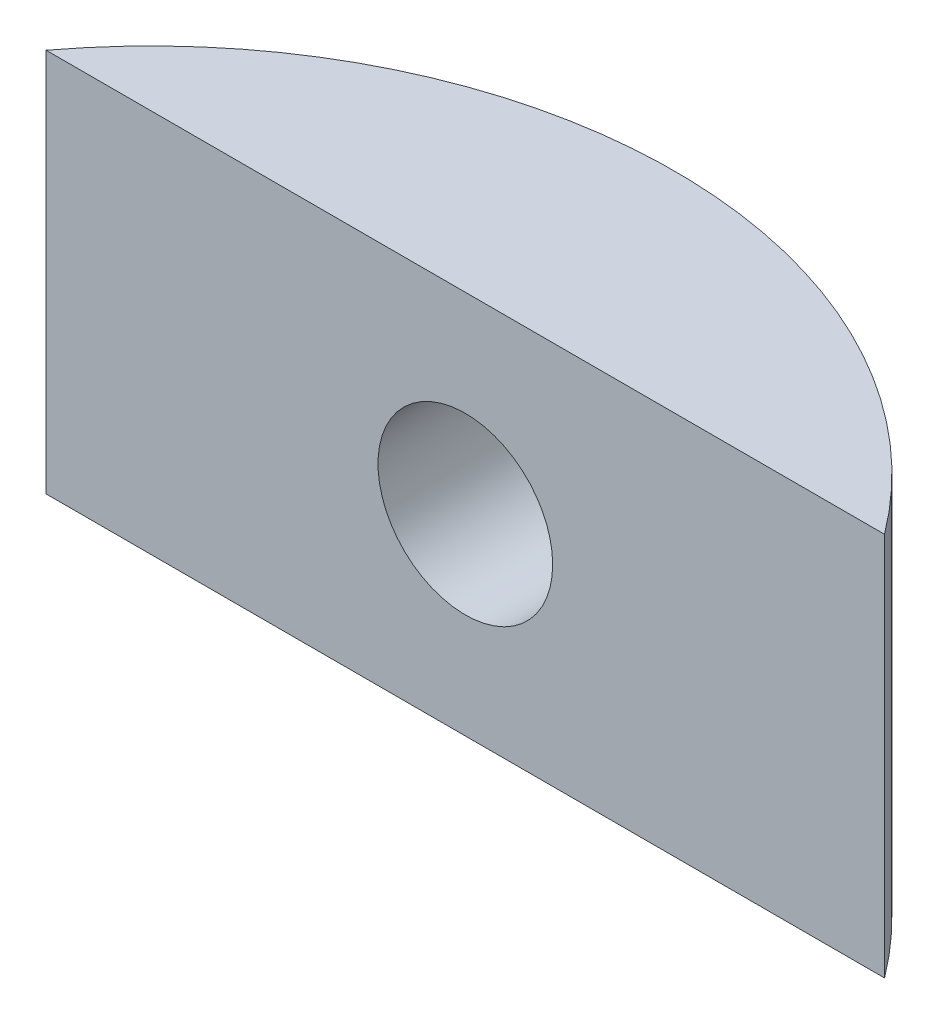
from build123d import *

# Parameters (mm, degrees)
EXTRUDE_1_DEPTH     = 11
CUT_EXTRUDE_2_DEPTH = 5


with BuildPart() as part:
    # 草图2 → 凸台-拉伸1 (new body)
    with BuildSketch(Plane(origin=(0, 0, 0), x_dir=(1, 0, 0), z_dir=(0, 1, 0))):
        with BuildLine():
            Line((-12, 9), (0, 9))
            Line((0, 9), (12, 9))
            ThreePointArc((12, 9), (0, 15), (-12, 9))
        make_face()
    extrude(amount=EXTRUDE_1_DEPTH)

    # 草图3 → 切除-拉伸2 (cut)
    with BuildSketch(Plane.XY.offset(-9)):
        with BuildLine():
            ThreePointArc((0, 8), (-2.5, 5.5), (0, 3))
            Line((0, 3), (0, 8))
        make_face()
        with BuildLine():
            Line((0, 8), (0, 3))
            ThreePointArc((0, 3), (1.767766953, 3.732233047), (2.5, 5.5))
            ThreePointArc((2.5, 5.5), (1.767766953, 7.267766953), (0, 8))
        make_face()
    extrude(amount=-CUT_EXTRUDE_2_DEPTH, mode=Mode.SUBTRACT)


solid = part.part
